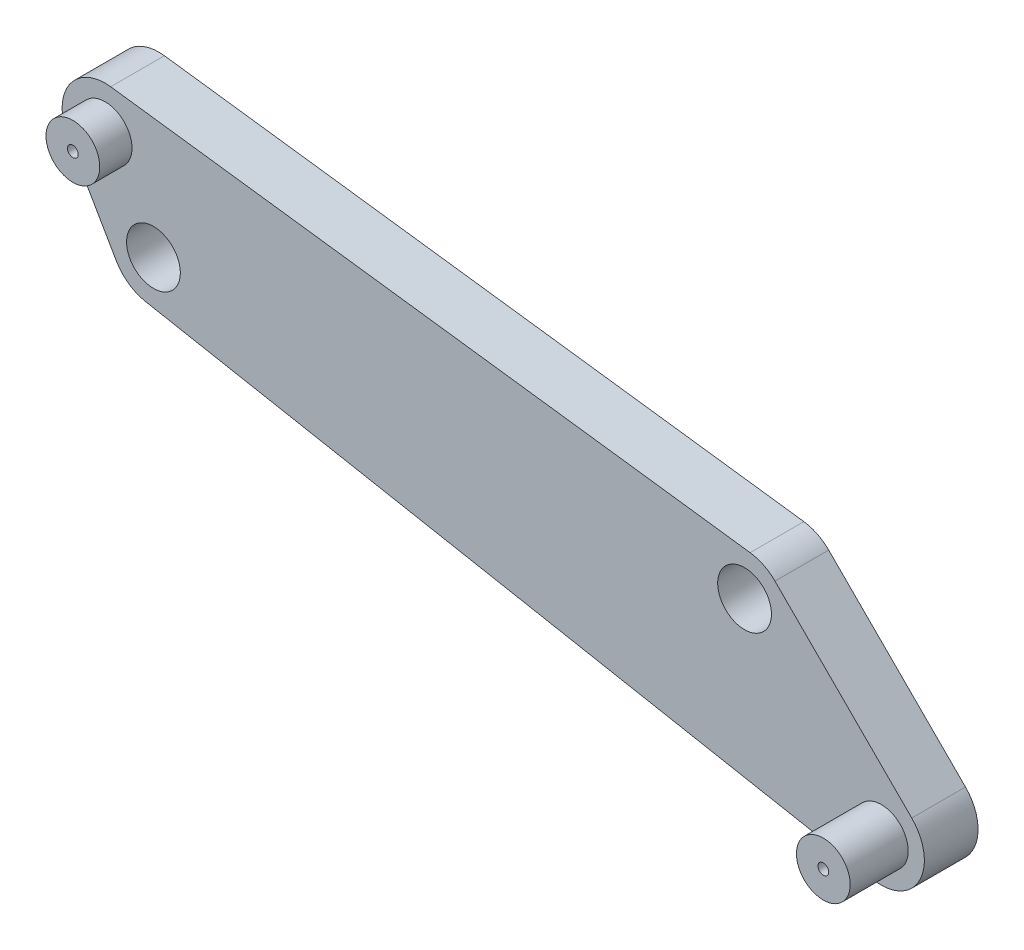
from build123d import *

# Parameters (mm, degrees)
SKETCH2_R           = 2.5
BOSS_EXTRUDE1_DEPTH = 5
SKETCH4_R           = 2.5
SKETCH4_R_2         = 0.5
BOSS_EXTRUDE3_DEPTH = 8
SKETCH5_R           = 2.5
SKETCH5_R_2         = 0.5
BOSS_EXTRUDE4_DEPTH = 2.4


with BuildPart() as part:
    # Sketch2 → Boss-Extrude1 (new body)
    with BuildSketch(Plane.XY):
        with BuildLine():
            Line((-58.980456911, 11.76034449), (0.519543089, 3.966115855))
            ThreePointArc((0.519543089, 3.966115855), (1.767996055, 3.588062144), (2.828427125, 2.828427125))
            Line((2.828427125, 2.828427125), (15.556349186, -9.899494937))
            ThreePointArc((15.556349186, -9.899494937), (16.265540761, -14.594805544), (11.989145433, -16.659106246))
            Line((11.989145433, -16.659106246), (-55.738776628, -3.931184185))
            ThreePointArc((-55.738776628, -3.931184185), (-57.312663934, -3.263676689), (-58.464101615, -2))
            Line((-58.464101615, -2), (-62.964101615, 5.794228634))
            ThreePointArc((-62.964101615, 5.794228634), (-62.826595982, 10.015435327), (-58.980456911, 11.76034449))
        make_face()
        with Locations((-55, 0)):
            Circle(SKETCH2_R, mode=Mode.SUBTRACT)
        with Locations((-59.5, 7.794228634)):
            Circle(SKETCH2_R, mode=Mode.SUBTRACT)
        Circle(SKETCH2_R, mode=Mode.SUBTRACT)
        with Locations((12.727922061, -12.727922061)):
            Circle(SKETCH2_R, mode=Mode.SUBTRACT)
    extrude(amount=BOSS_EXTRUDE1_DEPTH)

    # Sketch4 → Boss-Extrude3 (add)
    # profile 1 of 2: a face of its own
    with BuildSketch(Plane(origin=(0, 0, 0), x_dir=(-1, 0, 0), z_dir=(0, 0, -1))):
        with Locations((59.5, 7.794228634)):
            Circle(SKETCH4_R)
        with Locations((59.5, 7.794228634)):
            Circle(SKETCH4_R_2, mode=Mode.SUBTRACT)
    # profile 2 of 2: a face of its own
    with BuildSketch(Plane(origin=(0, 0, 0), x_dir=(-1, 0, 0), z_dir=(0, 0, -1))):
        with Locations((-12.727922061, -12.727922061)):
            Circle(SKETCH4_R)
        with Locations((-12.727922061, -12.727922061)):
            Circle(SKETCH4_R_2, mode=Mode.SUBTRACT)
    extrude(amount=-BOSS_EXTRUDE3_DEPTH)

    # Sketch5 → Boss-Extrude4 (add)
    with BuildSketch(Plane.XY.offset(8)):
        with Locations((12.727922061, -12.727922061)):
            Circle(SKETCH5_R)
        with Locations(Location((12.727922061, -12.727922061, 0), (0, 0, 180))):
            Circle(SKETCH5_R_2, mode=Mode.SUBTRACT)
    extrude(amount=BOSS_EXTRUDE4_DEPTH)


solid = part.part
